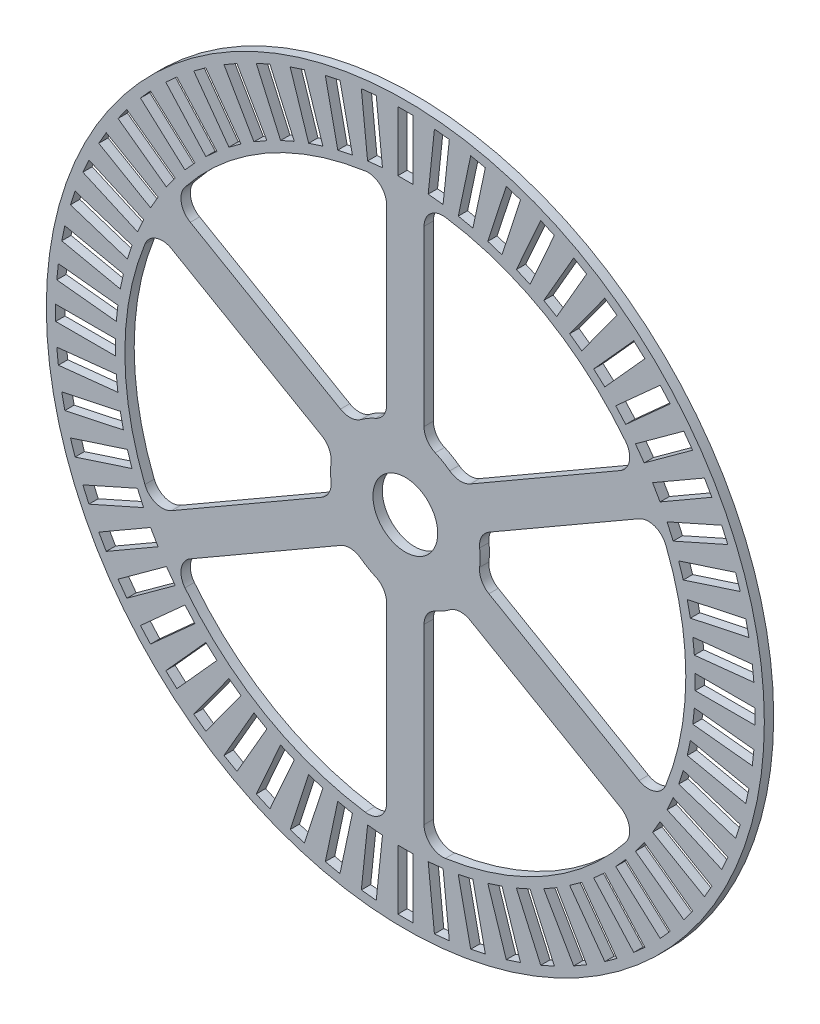
from build123d import *

# Parameters (mm, degrees)
SKETCH1_R           = 60.96
SKETCH1_R_2         = 47.625
BOSS_EXTRUDE1_DEPTH = 1.5875
SKETCH4_W           = 2.54
SKETCH4_H           = 10.16
CUT_EXTRUDE3_DEPTH  = 5.08
CIRPATTERN2_COUNT   = 60
SKETCH8_R           = 5.5
BOSS_EXTRUDE2_DEPTH = 1.5875
FILLET1_R           = 3.175


with BuildPart() as part:
    # Sketch1 → Boss-Extrude1 (new body)
    with BuildSketch(Plane.XY):
        Circle(SKETCH1_R)
        Circle(SKETCH1_R_2, mode=Mode.SUBTRACT)
    extrude(amount=BOSS_EXTRUDE1_DEPTH)

    # Sketch4 → Cut-Extrude3 (cut)
    with BuildSketch(Plane.XY.offset(1.5875)):
        with Locations((0, 54.2925)):
            Rectangle(SKETCH4_W, SKETCH4_H)
    cut_extrude3 = extrude(amount=-CUT_EXTRUDE3_DEPTH, mode=Mode.SUBTRACT)

    # CirPattern2: Cut-Extrude3 ×60 about axis
    cirpattern2_axis = Axis((0, 0, 1.5875), (0, 0, 1))
    for i in range(1, CIRPATTERN2_COUNT):
        add(cut_extrude3.rotate(cirpattern2_axis, i * 360 / CIRPATTERN2_COUNT), mode=Mode.SUBTRACT)

    # Sketch8 → Boss-Extrude2 (add)
    with BuildSketch(Plane.XY):
        with BuildLine():
            Line((-3.175, 12.296722124), (-3.175, 47.519048812))
            ThreePointArc((-3.175, 47.519048812), (0, 47.625), (3.175, 47.519048812))
            Line((3.175, 47.519048812), (3.175, 12.296722124))
            ThreePointArc((3.175, 12.296722124), (6.35, 10.998522628), (9.061773743, 8.897991719))
            Line((9.061773743, 8.897991719), (39.565203435, 26.509155063))
            ThreePointArc((39.565203435, 26.509155063), (41.244459855, 23.8125), (42.740203435, 21.009893749))
            Line((42.740203435, 21.009893749), (12.236773743, 3.398730405))
            ThreePointArc((12.236773743, 3.398730405), (12.7, 0), (12.236773743, -3.398730405))
            Line((12.236773743, -3.398730405), (42.740203435, -21.009893749))
            ThreePointArc((42.740203435, -21.009893749), (41.244459855, -23.8125), (39.565203435, -26.509155063))
            Line((39.565203435, -26.509155063), (9.061773743, -8.897991719))
            ThreePointArc((9.061773743, -8.897991719), (6.35, -10.998522628), (3.175, -12.296722124))
            Line((3.175, -12.296722124), (3.175, -47.519048812))
            ThreePointArc((3.175, -47.519048812), (0, -47.625), (-3.175, -47.519048812))
            Line((-3.175, -47.519048812), (-3.175, -12.296722124))
            ThreePointArc((-3.175, -12.296722124), (-6.35, -10.998522628), (-9.061773743, -8.897991719))
            Line((-9.061773743, -8.897991719), (-39.565203435, -26.509155063))
            ThreePointArc((-39.565203435, -26.509155063), (-41.244459855, -23.8125), (-42.740203435, -21.009893749))
            Line((-42.740203435, -21.009893749), (-12.236773743, -3.398730405))
            ThreePointArc((-12.236773743, -3.398730405), (-12.7, 0), (-12.236773743, 3.398730405))
            Line((-12.236773743, 3.398730405), (-42.740203435, 21.009893749))
            ThreePointArc((-42.740203435, 21.009893749), (-41.244459855, 23.8125), (-39.565203435, 26.509155063))
            Line((-39.565203435, 26.509155063), (-9.061773743, 8.897991719))
            ThreePointArc((-9.061773743, 8.897991719), (-6.35, 10.998522628), (-3.175, 12.296722124))
        make_face()
        Circle(SKETCH8_R, mode=Mode.SUBTRACT)
    extrude(amount=BOSS_EXTRUDE2_DEPTH)

    # Fillet1
    fillet1_edges = [part.edges().sort_by_distance(p)[0] for p in [
        (12.236773743, -3.398730405, 0.79375),
        (12.236773743, 3.398730405, 0.79375),
        (9.061773743, -8.897991719, 0.79375),
        (3.175, -12.296722124, 0.79375),
        (-3.175, -12.296722124, 0.79375),
        (-9.061773743, -8.897991719, 0.79375),
        (-12.236773743, 3.398730405, 0.79375),
        (-12.236773743, -3.398730405, 0.79375),
        (-3.175, 12.296722124, 0.79375),
        (-9.061773743, 8.897991719, 0.79375),
        (3.175, 12.296722124, 0.79375),
        (9.061773743, 8.897991719, 0.79375),
        (3.175, 47.519048812, 0.79375),
        (39.565203435, 26.509155063, 0.79375),
        (42.740203435, 21.009893749, 0.79375),
        (42.740203435, -21.009893749, 0.79375),
        (39.565203435, -26.509155063, 0.79375),
        (3.175, -47.519048812, 0.79375),
        (-3.175, -47.519048812, 0.79375),
        (-39.565203435, -26.509155063, 0.79375),
        (-42.740203435, -21.009893749, 0.79375),
        (-42.740203435, 21.009893749, 0.79375),
        (-39.565203435, 26.509155063, 0.79375),
        (-3.175, 47.519048812, 0.79375),
    ]]
    fillet(fillet1_edges, radius=FILLET1_R)


solid = part.part
